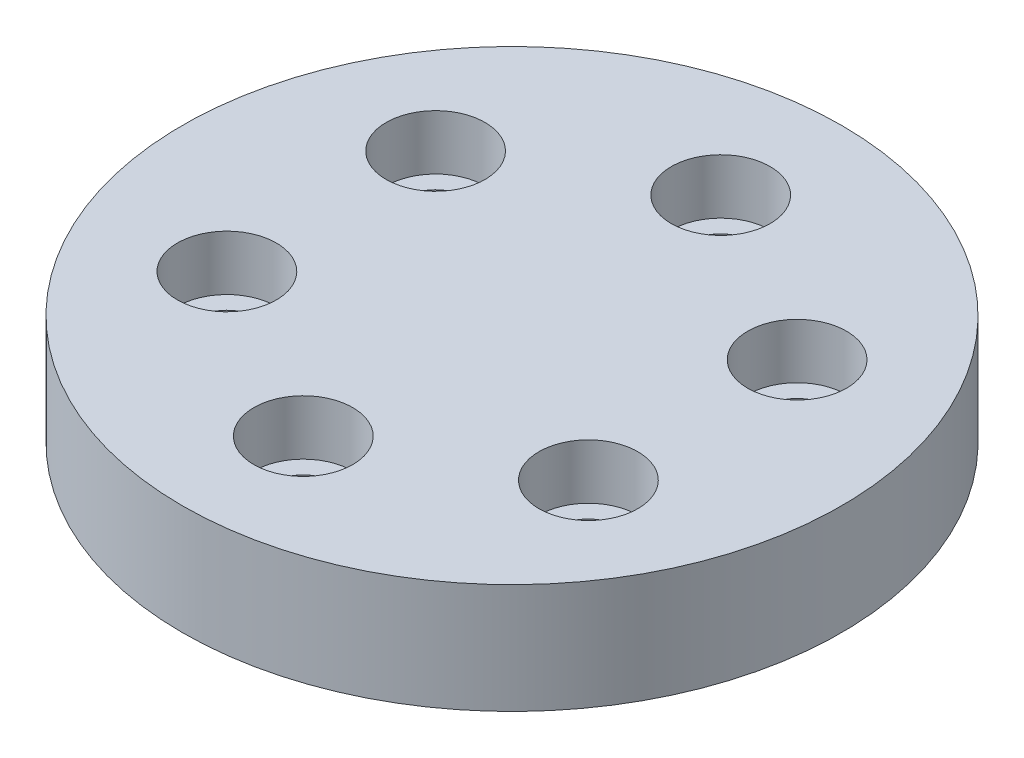
from build123d import *

# Parameters (mm, degrees)
SKETCH1_R           = 30
BOSS_EXTRUDE1_DEPTH = 10
SKETCH2_R           = 4.5
CUT_EXTRUDE1_DEPTH  = 5
SKETCH3_R           = 2.75
CUT_EXTRUDE2_DEPTH  = 43.720018727


with BuildPart() as part:
    # Sketch1 → Boss-Extrude1 (new body)
    with BuildSketch(Plane(origin=(0, 0, 0), x_dir=(1, 0, 0), z_dir=(0, 1, 0))):
        with Locations(Location((0, 0, 0), (0, 0, 270))):
            Circle(SKETCH1_R)
    extrude(amount=BOSS_EXTRUDE1_DEPTH)

    # Sketch2 → Cut-Extrude1 (cut)
    with BuildSketch(Plane(origin=(0, 10, 0), x_dir=(1, 0, 0), z_dir=(0, 1, 0))):
        with Locations(Location((0, 19, 0), (0, 0, 270))):
            Circle(SKETCH2_R)
        with Locations(Location((16.454482672, 9.5, 0), (0, 0, 270))):
            Circle(SKETCH2_R)
        with Locations(Location((16.454482672, -9.5, 0), (0, 0, 270))):
            Circle(SKETCH2_R)
        with Locations(Location((0, -19, 0), (0, 0, 270))):
            Circle(SKETCH2_R)
        with Locations(Location((-16.454482672, -9.5, 0), (0, 0, 270))):
            Circle(SKETCH2_R)
        with Locations(Location((-16.454482672, 9.5, 0), (0, 0, 270))):
            Circle(SKETCH2_R)
    extrude(amount=-CUT_EXTRUDE1_DEPTH, mode=Mode.SUBTRACT)

    # Sketch3 → Cut-Extrude2 (cut, through all)
    with BuildSketch(Plane(origin=(0, 5, 0), x_dir=(1, 0, 0), z_dir=(0, 1, 0))):
        with Locations(Location((0, 19, 0), (0, 0, 270))):
            Circle(SKETCH3_R)
        with Locations(Location((16.454482672, 9.5, 0), (0, 0, 270))):
            Circle(SKETCH3_R)
        with Locations(Location((16.454482672, -9.5, 0), (0, 0, 270))):
            Circle(SKETCH3_R)
        with Locations(Location((0, -19, 0), (0, 0, 270))):
            Circle(SKETCH3_R)
        with Locations(Location((-16.454482672, -9.5, 0), (0, 0, 270))):
            Circle(SKETCH3_R)
        with Locations(Location((-16.454482672, 9.5, 0), (0, 0, 270))):
            Circle(SKETCH3_R)
    extrude(amount=-CUT_EXTRUDE2_DEPTH, mode=Mode.SUBTRACT)


solid = part.part
